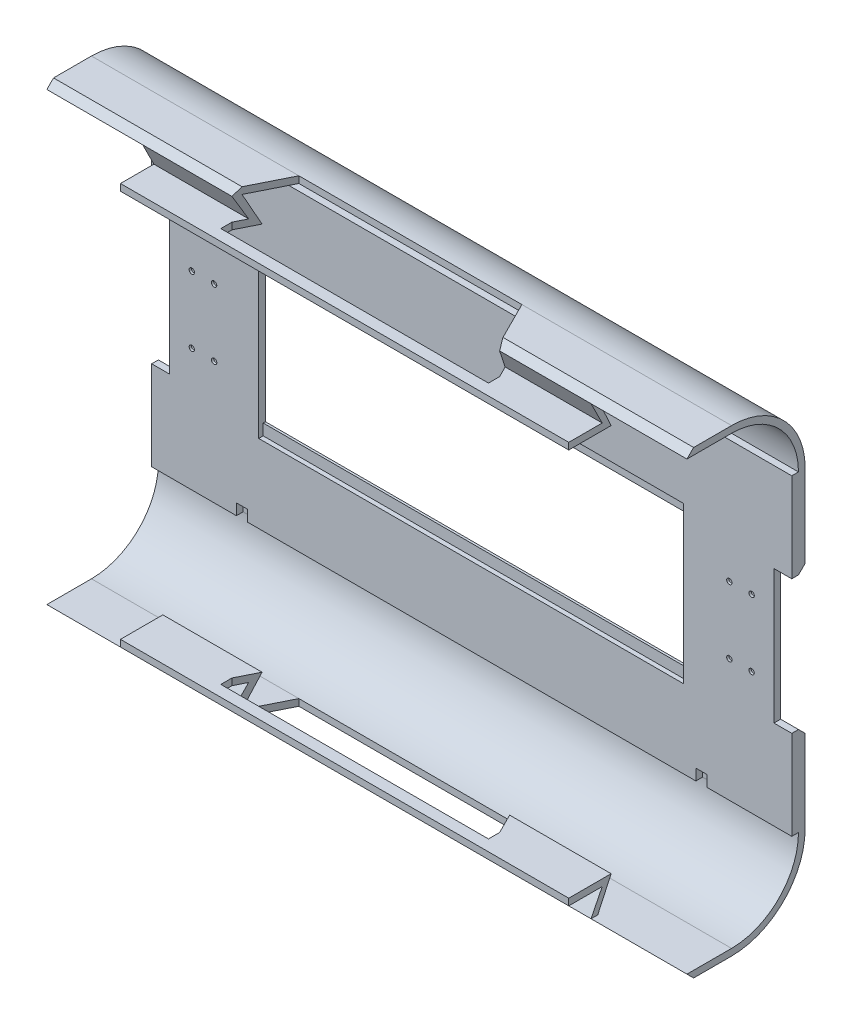
from build123d import *

# Parameters (mm, degrees)
EXTRUDE_1_DEPTH          = 3
EXTRUDE_2_DEPTH          = 287
SKETCH_4_W               = 21.736589458
SKETCH_4_H               = 200
CUT_EXTRUDE_1_DEPTH      = 43
SKETCH_5_W               = 23.415155123
SKETCH_5_H               = 200
CUT_EXTRUDE_2_DEPTH      = 43
CUT_EXTRUDE_3_DEPTH      = 259.263552403
HOLE_WIZARD_1_AT_2_COUNT = 2
HOLE_WIZARD_1_AT_2_PITCH = 31.622776602
HOLE_WIZARD_1_AT_3_COUNT = 2
HOLE_WIZARD_1_AT_3_PITCH = 10
HOLE_WIZARD_1_AT_4_COUNT = 2
HOLE_WIZARD_1_AT_4_PITCH = 242.860042
HOLE_WIZARD_1_AT_5_COUNT = 2
HOLE_WIZARD_1_AT_5_PITCH = 241
HOLE_WIZARD_1_AT_6_COUNT = 2
HOLE_WIZARD_1_AT_6_PITCH = 232.939906414
HOLE_WIZARD_1_AT_7_COUNT = 2
HOLE_WIZARD_1_AT_7_PITCH = 231
HOLE_WIZARD_1_AT_8_COUNT = 2
HOLE_WIZARD_1_AT_8_PITCH = 30
SKETCH_10_W              = 190.5
SKETCH_10_H              = 70
CUT_EXTRUDE_4_DEPTH      = 2
SKETCH_11_W              = 190.5
SKETCH_11_H              = 60
CUT_EXTRUDE_5_DEPTH      = 1


with BuildPart() as part:
    # 草图1 → 凸台-拉伸1 (new body)
    with BuildSketch(Plane.XY):
        Polygon((-143.25, 30), (-143.25, 70), (-105.25, 70), (-105.25, 65), (-100.25, 65), (-100.25, 70), (100.75, 70), (100.75, 65), (105.75, 65), (105.75, 70), (143.75, 70), (143.75, 30), (135.75, 30), (135.75, -30), (143.75, -30), (143.75, -70), (105.75, -70), (105.75, -65), (100.75, -65), (100.75, -70), (-100.25, -70), (-100.25, -65), (-105.25, -65), (-105.25, -70), (-143.25, -70), (-143.25, -30), (-135.25, -30), (-135.25, 30), align=None)
    extrude(amount=EXTRUDE_1_DEPTH)

    # 草图2 → 凸台-拉伸2 (add)
    with BuildSketch(Plane.ZY.offset(143.25)):
        with BuildLine():
            Line((0, 70), (0, 30))
            Line((0, 30), (-3, 33))
            Line((-3, 33), (-3, 70))
            ThreePointArc((-3, 70), (6.665476221, 93.334523779), (30, 103))
            Line((30, 103), (47, 103))
            Line((47, 103), (50, 100))
            Line((50, 100), (45, 90))
            Line((45, 90), (60, 90))
            Line((60, 90), (60, 87))
            Line((60, 87), (41, 87))
            Line((41, 87), (47, 100))
            Line((47, 100), (30, 100))
            ThreePointArc((30, 100), (8.786796564, 91.213203436), (0, 70))
        make_face()
        with BuildLine():
            Line((30, -100), (47, -100))
            Line((47, -100), (41, -87))
            Line((41, -87), (60, -87))
            Line((60, -87), (60, -90))
            Line((60, -90), (45, -90))
            Line((45, -90), (50, -100))
            Line((50, -100), (47, -103))
            Line((47, -103), (30, -103))
            ThreePointArc((30, -103), (6.665476221, -93.334523779), (-3, -70))
            Line((-3, -70), (-3, -33))
            Line((-3, -33), (0, -30))
            Line((0, -30), (0, -70))
            ThreePointArc((0, -70), (8.786796564, -91.213203436), (30, -100))
        make_face()
    extrude(amount=-EXTRUDE_2_DEPTH)

    # 草图4 → 切除-拉伸1 (cut)
    with BuildSketch(Plane.ZY.offset(143.25)):
        with Locations((49.368294729, 0)):
            Rectangle(SKETCH_4_W, SKETCH_4_H)
    extrude(amount=-CUT_EXTRUDE_1_DEPTH, mode=Mode.SUBTRACT)

    # 草图5 → 切除-拉伸2 (cut)
    with BuildSketch(Plane(origin=(143.75, 0, 0), x_dir=(0, 0, -1), z_dir=(1, 0, 0))):
        with Locations((-51.459603014, 0)):
            Rectangle(SKETCH_5_W, SKETCH_5_H)
    extrude(amount=-CUT_EXTRUDE_2_DEPTH, mode=Mode.SUBTRACT)

    # 草图6 → 切除-拉伸3 (cut, through all)
    with BuildSketch(Plane(origin=(0, 103, 0), x_dir=(1, 0, 0), z_dir=(0, 1, 0))):
        Polygon((0.25, -30), (-50.25, -30), (-60.25, -50), (-60.25, -55), (59.75, -55), (59.75, -50), (49.75, -30), align=None)
    extrude(amount=-CUT_EXTRUDE_3_DEPTH, mode=Mode.SUBTRACT)

    # 草图9 → 大小六角凹头盖螺钉柱孔1 (revolve, cut)
    with BuildSketch(Plane(origin=(115.75, 15, 0), x_dir=(0, 1, 0), z_dir=(1, 0, 0))):
        Polygon((0, 0), (0, 60), (1.2, 60), (1.2, 2), (2.15, 2), (2.15, 0.024142219), (2.175, 0), align=None)
    hole_wizard_1 = revolve(axis=Axis((115.75, 15, -6.35), (0, 0, 1)), mode=Mode.SUBTRACT)

    # 大小六角凹头盖螺钉柱孔1 at 2: 大小六角凹头盖螺钉柱孔1 ×2
    with Locations(*[Vector(0.3162277660168351, -0.9486832980505148, 0) * (i * HOLE_WIZARD_1_AT_2_PITCH) for i in range(1, HOLE_WIZARD_1_AT_2_COUNT)]):
        add(hole_wizard_1, mode=Mode.SUBTRACT)

    # 大小六角凹头盖螺钉柱孔1 at 3: 大小六角凹头盖螺钉柱孔1 ×2
    with Locations(*[(i * HOLE_WIZARD_1_AT_3_PITCH, 0, 0) for i in range(1, HOLE_WIZARD_1_AT_3_COUNT)]):
        add(hole_wizard_1, mode=Mode.SUBTRACT)

    # 大小六角凹头盖螺钉柱孔1 at 4: 大小六角凹头盖螺钉柱孔1 ×2
    with Locations(*[Vector(-0.9923410949607508, -0.12352793713204367, 0) * (i * HOLE_WIZARD_1_AT_4_PITCH) for i in range(1, HOLE_WIZARD_1_AT_4_COUNT)]):
        add(hole_wizard_1, mode=Mode.SUBTRACT)

    # 大小六角凹头盖螺钉柱孔1 at 5: 大小六角凹头盖螺钉柱孔1 ×2
    with Locations(*[(-i * HOLE_WIZARD_1_AT_5_PITCH, 0, 0) for i in range(1, HOLE_WIZARD_1_AT_5_COUNT)]):
        add(hole_wizard_1, mode=Mode.SUBTRACT)

    # 大小六角凹头盖螺钉柱孔1 at 6: 大小六角凹头盖螺钉柱孔1 ×2
    with Locations(*[Vector(-0.9916720735252418, -0.12878858097730414, 0) * (i * HOLE_WIZARD_1_AT_6_PITCH) for i in range(1, HOLE_WIZARD_1_AT_6_COUNT)]):
        add(hole_wizard_1, mode=Mode.SUBTRACT)

    # 大小六角凹头盖螺钉柱孔1 at 7: 大小六角凹头盖螺钉柱孔1 ×2
    with Locations(*[(-i * HOLE_WIZARD_1_AT_7_PITCH, 0, 0) for i in range(1, HOLE_WIZARD_1_AT_7_COUNT)]):
        add(hole_wizard_1, mode=Mode.SUBTRACT)

    # 大小六角凹头盖螺钉柱孔1 at 8: 大小六角凹头盖螺钉柱孔1 ×2
    with Locations(*[(0, -i * HOLE_WIZARD_1_AT_8_PITCH, 0) for i in range(1, HOLE_WIZARD_1_AT_8_COUNT)]):
        add(hole_wizard_1, mode=Mode.SUBTRACT)

    # 草图10 → 切除-拉伸4 (cut)
    with BuildSketch(Plane.XY.offset(3)):
        Rectangle(SKETCH_10_W, SKETCH_10_H)
    extrude(amount=-CUT_EXTRUDE_4_DEPTH, mode=Mode.SUBTRACT)

    # 草图11 → 切除-拉伸5 (cut)
    with BuildSketch(Plane.XY):
        Rectangle(SKETCH_11_W, SKETCH_11_H)
    extrude(amount=CUT_EXTRUDE_5_DEPTH, mode=Mode.SUBTRACT)


solid = part.part
